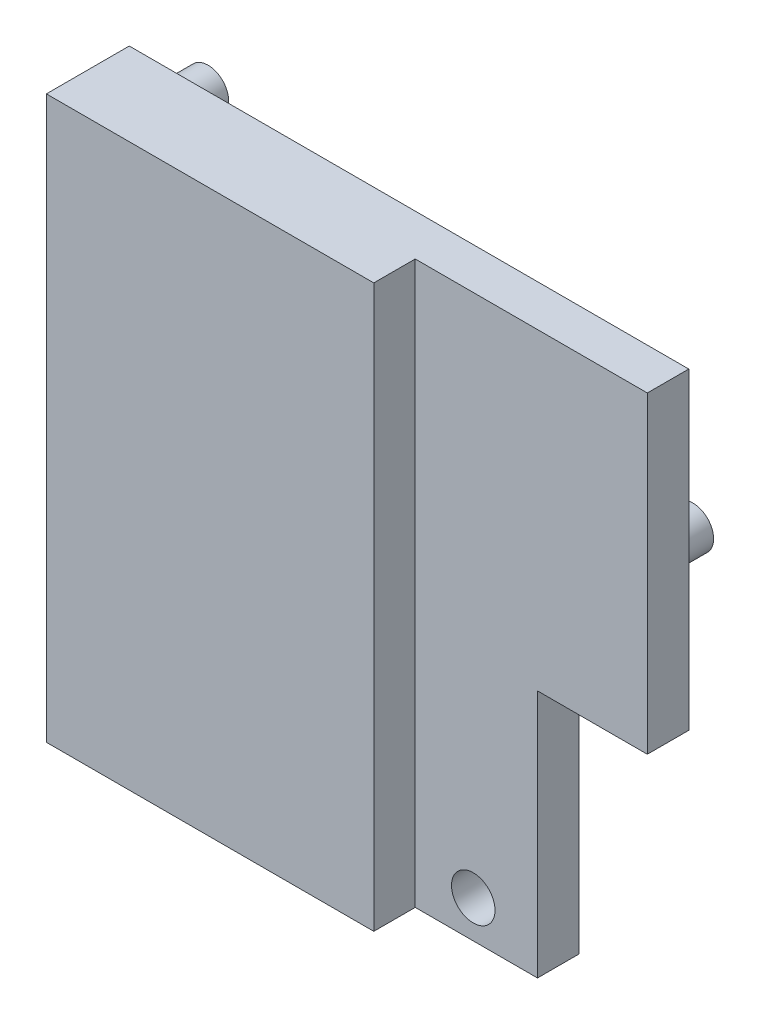
from build123d import *

# Parameters (mm, degrees)
SKETCH1_W           = 27
SKETCH1_H           = 27.3
SKETCH1_R           = 1.05
BOSS_EXTRUDE1_DEPTH = 2
SKETCH2_W           = 5.3
SKETCH2_H           = 12
CUT_EXTRUDE1_DEPTH  = 79.521414277
SKETCH3_R           = 1
BOSS_EXTRUDE2_DEPTH = 4
SKETCH4_W           = 15.8
SKETCH4_H           = 27.3
BOSS_EXTRUDE3_DEPTH = 2
SKETCH5_W           = 27
SKETCH5_H           = 0.2
CUT_EXTRUDE2_DEPTH  = 79.597789409


with BuildPart() as part:
    # Sketch1 → Boss-Extrude1 (new body)
    with BuildSketch(Plane.XY):
        with Locations((40.15, -43.65)):
            Rectangle(SKETCH1_W, SKETCH1_H)
        with Locations((45.25, -55.5)):
            Circle(SKETCH1_R, mode=Mode.SUBTRACT)
    extrude(amount=BOSS_EXTRUDE1_DEPTH)

    # Sketch2 → Cut-Extrude1 (cut, through all)
    with BuildSketch(Plane.XY.offset(2)):
        with Locations((51, -51.3)):
            Rectangle(SKETCH2_W, SKETCH2_H)
    extrude(amount=-CUT_EXTRUDE1_DEPTH, mode=Mode.SUBTRACT)

    # Sketch3 → Boss-Extrude2 (add)
    with BuildSketch(Plane.XY.offset(2)):
        with Locations((28.45, -32.1)):
            Circle(SKETCH3_R)
        with Locations((51.85, -38.7)):
            Circle(SKETCH3_R)
    extrude(amount=-BOSS_EXTRUDE2_DEPTH)

    # Sketch4 → Boss-Extrude3 (add)
    with BuildSketch(Plane.XY.offset(2)):
        with Locations((34.55, -43.65)):
            Rectangle(SKETCH4_W, SKETCH4_H)
    extrude(amount=BOSS_EXTRUDE3_DEPTH)

    # Sketch5 → Cut-Extrude2 (cut, through all)
    with BuildSketch(Plane(origin=(0, 0, 0), x_dir=(-1, 0, 0), z_dir=(0, 0, -1))):
        with Locations((-40.15, -30.1)):
            Rectangle(SKETCH5_W, SKETCH5_H)
    extrude(amount=-CUT_EXTRUDE2_DEPTH, mode=Mode.SUBTRACT)


solid = part.part
